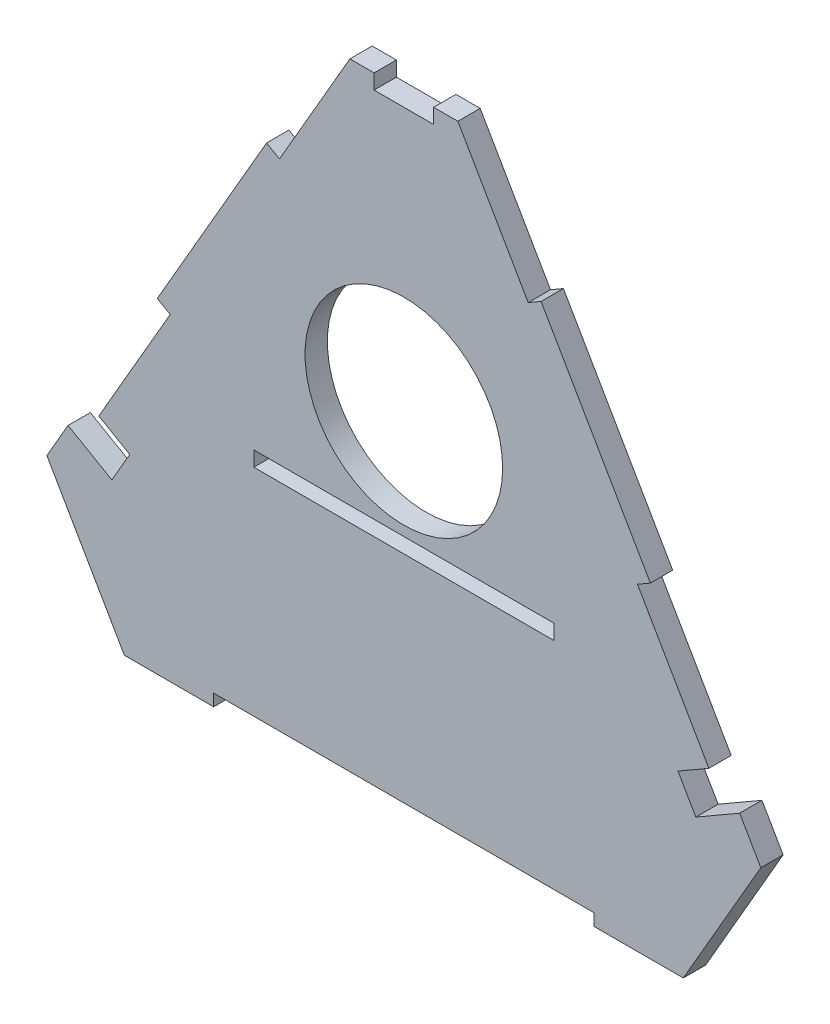
from build123d import *

# Parameters (mm, degrees)
BOSS_EXTRUDE1_DEPTH     = 4.7625
SCALE2_SCALE_X          = 0.25
SCALE2_SCALE_Y          = 0.25
SCALE2_SCALE_Z          = 1
SKETCH8_R               = 21.082
CUT_EXTRUDE5_DEPTH      = 286.136245759
CUT_EXTRUDE8_DEPTH      = 286.136245759
CUT_EXTRUDE8_DEPTH_BACK = 286.136245759
SKETCH9_W               = 64.0334
SKETCH9_H               = 3.2004
SKETCH10_W              = 12.7
SKETCH10_H              = 3.175
CUT_EXTRUDE9_DEPTH      = 286.136245759
CUT_EXTRUDE10_DEPTH     = 286.136245759
CUT_EXTRUDE11_DEPTH     = 286.136245759
CUT_EXTRUDE12_DEPTH     = 286.136245759
SKETCH18_W              = 40.580539391
SKETCH18_H              = 7.62
BOSS_EXTRUDE2_DEPTH     = 4.7625
CUT_EXTRUDE13_REACH     = 286.64


with BuildPart() as part:
    # Sketch3 → Boss-Extrude1 (new body)
    with BuildSketch(Plane.XY):
        Polygon((312.000738686, 65.991135768), (166.792028218, 317.5), (-166.792028218, 317.5), (-312.000738686, 65.991135768), (-276.650369343, 4.7625), (276.650369343, 4.7625), align=None)
        Polygon((-166.792028218, 317.5), (166.792028218, 317.5), (60.750369343, 501.169540891), (-60.750369343, 501.169540891), align=None)
    extrude(amount=BOSS_EXTRUDE1_DEPTH)


with BuildPart() as part_1:
    # Scale2: scaled about (0, 198.568597006, 2.38125)
    add(part.part.scale((SCALE2_SCALE_X, SCALE2_SCALE_Y, SCALE2_SCALE_Z), about=(0, 198.568597006, 2.38125)))

    # Sketch8 → Cut-Extrude5 (cut, through all)
    with BuildSketch(Plane.XY.offset(4.7625)):
        with Locations((0, 214.887072754)):
            Circle(SKETCH8_R)
    extrude(amount=-CUT_EXTRUDE5_DEPTH, mode=Mode.SUBTRACT)

    # Sketch9 → Cut-Extrude8 (cut, two sides: drawn at the far end of the back side and taken through both)
    with BuildSketch(Plane.XY.offset(4.7625).offset(-CUT_EXTRUDE8_DEPTH_BACK)):
        with Locations((0, 190.118897754)):
            Rectangle(SKETCH9_W, SKETCH9_H)
    extrude(amount=CUT_EXTRUDE8_DEPTH + CUT_EXTRUDE8_DEPTH_BACK, mode=Mode.SUBTRACT)

    # Sketch10 → Cut-Extrude9 (cut, through all)
    with BuildSketch(Plane.XY.offset(4.7625)):
        with Locations((0, 272.631332977)):
            Rectangle(SKETCH10_W, SKETCH10_H)
    extrude(amount=-CUT_EXTRUDE9_DEPTH, mode=Mode.SUBTRACT)

    # Sketch11 → Cut-Extrude10 (cut, through all)
    with BuildSketch(Plane.XY.offset(4.7625)):
        Polygon((15.187592336, 274.218832977), (29.284592336, 249.802112743), (26.534961679, 248.214612743), (11.521418126, 274.218832977), align=None)
        Polygon((-29.284592336, 249.802112743), (-26.534961679, 248.214612743), (-11.521418126, 274.218832977), (-15.187592336, 274.218832977), align=None)
    extrude(amount=-CUT_EXTRUDE10_DEPTH, mode=Mode.SUBTRACT)

    # Sketch12 → Cut-Extrude11 (cut, through all)
    with BuildSketch(Plane.XY.offset(4.7625)):
        Polygon((71.650184671, 176.422754325), (52.600184671, 209.418322209), (49.850554014, 207.830822209), (68.900554014, 174.835254325), align=None)
        Polygon((-71.650184671, 176.422754325), (-68.900554014, 174.835254325), (-49.850554014, 207.830822209), (-52.600184671, 209.418322209), align=None)
    extrude(amount=-CUT_EXTRUDE11_DEPTH, mode=Mode.SUBTRACT)

    # Sketch13 → Cut-Extrude12 (cut, through all)
    with BuildSketch(Plane.XY.offset(4.7625)):
        Polygon((78.000184671, 165.424231696), (76.167097567, 168.599231696), (62.550554014, 145.01468644), (65.300184671, 143.42718644), align=None)
        Polygon((-62.550554014, 145.01468644), (-65.300184671, 143.42718644), (-78.000184671, 165.424231696), (-76.167097567, 168.599231696), align=None)
    extrude(amount=-CUT_EXTRUDE12_DEPTH, mode=Mode.SUBTRACT)

    # Sketch18 → Boss-Extrude2 (add)
    with BuildSketch(Plane(origin=(0, 0, 0), x_dir=(-1, 0, 0), z_dir=(0, 0, -1))):
        Polygon((-40.580539391, 150.117072754), (-65.496418126, 150.117072754), (-59.630539391, 139.957072754), (-40.580539391, 139.957072754), (-40.580539391, 142.497072754), align=None)
        with Locations((-20.290269696, 146.307072754)):
            Rectangle(SKETCH18_W, SKETCH18_H)
        with Locations((20.290269696, 146.307072754)):
            Rectangle(SKETCH18_W, SKETCH18_H)
        Polygon((65.496418126, 150.117072754), (40.580539391, 150.117072754), (40.580539391, 142.497072754), (40.580539391, 139.957072754), (59.630539391, 139.957072754), align=None)
    extrude(amount=-BOSS_EXTRUDE2_DEPTH)

    # Sketch20 → Cut-Extrude13 (cut, up to next)
    with BuildSketch(Plane(origin=(0, 0, 0), x_dir=(-1, 0, 0), z_dir=(0, 0, -1)), mode=Mode.PRIVATE) as cut_extrude13_sk1:
        Polygon((68.900554014, 174.835254325), (65.090554014, 181.434367901), (58.491440438, 177.624367901), (62.301440438, 171.025254325), align=None)
    cut_extrude13_tool1 = extrude(cut_extrude13_sk1.sketch, amount=-CUT_EXTRUDE13_REACH, mode=Mode.PRIVATE) & part_1.part
    cut_extrude13 = cut_extrude13_tool1.solids().sort_by_distance((-63.695997, 176.229811, 0))[0]
    add(cut_extrude13, mode=Mode.SUBTRACT)

    # Mirror1: Cut-Extrude13 across plane
    add(cut_extrude13.mirror(Plane(origin=(0, 0, 0), x_dir=(0, 0, 1), z_dir=(1, 0, 0))), mode=Mode.SUBTRACT)


solid = part_1.part
